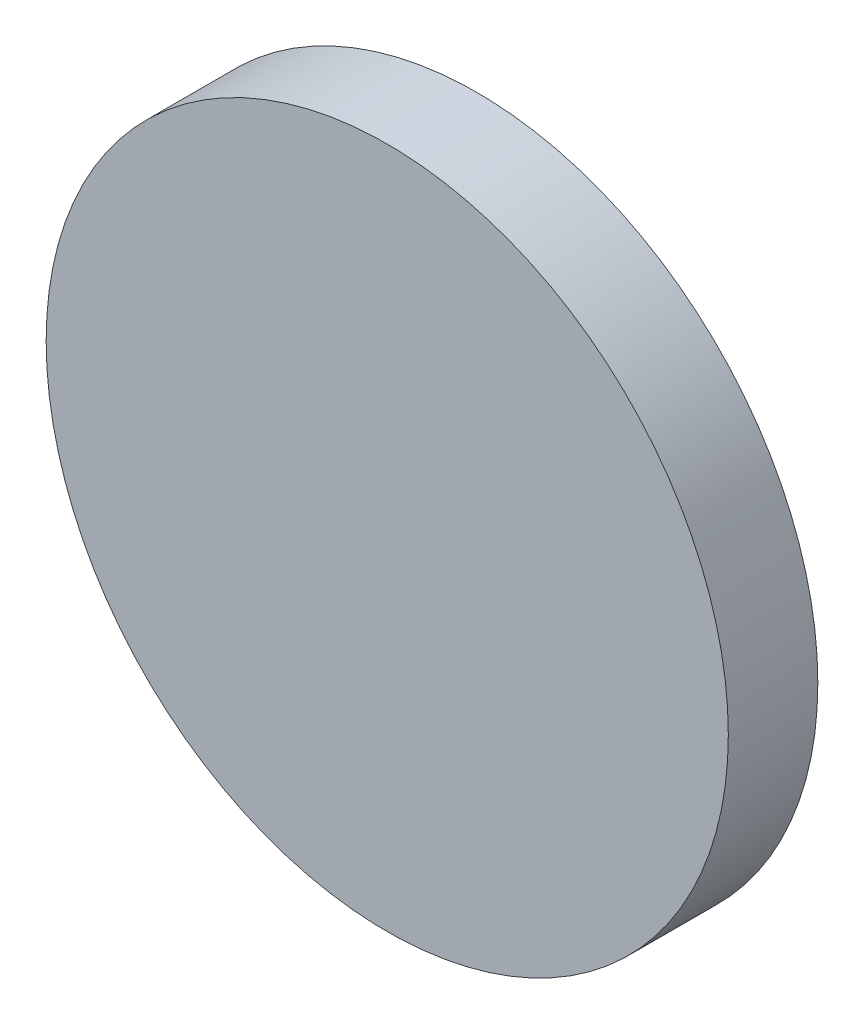
from build123d import *

# Parameters (mm, degrees)
SKETCH1_R           = 38.1
BOSS_EXTRUDE1_DEPTH = 10


with BuildPart() as part:
    # Sketch1 → Boss-Extrude1 (new body)
    with BuildSketch(Plane.XY):
        Circle(SKETCH1_R)
    extrude(amount=BOSS_EXTRUDE1_DEPTH)


solid = part.part
